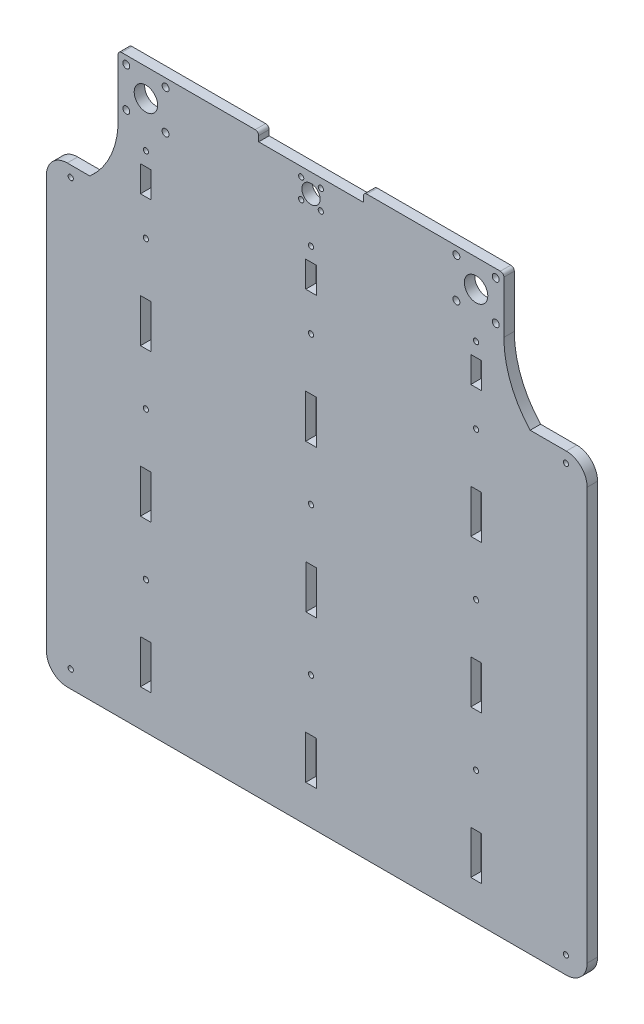
from build123d import *

# Parameters (mm, degrees)
CROQUIS1_R              = 1.5
CROQUIS1_W              = 6.2
CROQUIS1_H              = 25
CROQUIS1_H_2            = 15
CROQUIS1_R_2            = 2
CROQUIS1_R_3            = 6.75
CROQUIS1_R_4            = 5.25
SALIENTE_EXTRUIR1_DEPTH = 6


with BuildPart() as part:
    # Croquis1 → Saliente-Extruir1 (new body)
    with BuildSketch(Plane.XY):
        with BuildLine():
            Line((87.635637669, 16), (32.115377174, 16))
            ThreePointArc((32.115377174, 16), (30.701163612, 15.414213562), (30.115377174, 14))
            Line((30.115377174, 14), (30.115377174, 10.910010016))
            Line((30.115377174, 10.910010016), (-30.115377174, 10.910010016))
            Line((-30.115377174, 10.910010016), (-30.115377174, 14))
            ThreePointArc((-30.115377174, 14), (-30.701163612, 15.414213562), (-32.115377174, 16))
            Line((-32.115377174, 16), (-44.664398505, 16))
            Line((-44.664398505, 16), (-87.635637669, 16))
            Line((-87.635637669, 16), (-109, 16))
            ThreePointArc((-109, 16), (-110.414213562, 15.414213562), (-111, 14))
            Line((-111, 14), (-111, 0))
            Line((-111, 0), (-111, -15.999955929))
            ThreePointArc((-111, -15.999955929), (-114.684754838, -37.224148725), (-127.277573278, -54.701697231))
            Line((-127.277573278, -54.701697231), (-135.277573278, -54.701697231))
            Line((-135.277573278, -54.701697231), (-140.277573278, -54.701697231))
            ThreePointArc((-140.277573278, -54.701697231), (-148.762854653, -58.216415857), (-152.277573278, -66.701697231))
            Line((-152.277573278, -66.701697231), (-152.277573278, -303.912438798))
            ThreePointArc((-152.277573278, -303.912438798), (-148.762854653, -312.397720172), (-140.277573278, -315.912438798))
            Line((-140.277573278, -315.912438798), (-135.277573278, -315.912438798))
            Line((-135.277573278, -315.912438798), (-119.364295205, -315.912438798))
            Line((-119.364295205, -315.912438798), (119.364429455, -315.912438798))
            Line((119.364429455, -315.912438798), (130.295105026, -315.912438798))
            Line((130.295105026, -315.912438798), (146.942872896, -315.912438798))
            ThreePointArc((146.942872896, -315.912438798), (155.42815427, -312.397720172), (158.942872896, -303.912438798))
            Line((158.942872896, -303.912438798), (158.942872896, -70.770984471))
            Line((158.942872896, -70.770984471), (158.942872896, -66.701697231))
            ThreePointArc((158.942872896, -66.701697231), (155.42815427, -58.216415857), (146.942872896, -54.701697231))
            Line((146.942872896, -54.701697231), (126.134028278, -54.701697231))
            ThreePointArc((126.134028278, -54.701697231), (114.918041875, -36.777730062), (111, -15.999955929))
            Line((111, -15.999955929), (111, 14))
            ThreePointArc((111, 14), (110.414213562, 15.414213562), (109, 16))
            Line((109, 16), (87.635637669, 16))
        make_face()
        with Locations((-138.277573278, -305.912438798)):
            Circle(CROQUIS1_R, mode=Mode.SUBTRACT)
        with Locations((-95.05, -282.201697231)):
            Rectangle(CROQUIS1_W, CROQUIS1_H, mode=Mode.SUBTRACT)
        with Locations((-95, -239.701697231)):
            Circle(CROQUIS1_R, mode=Mode.SUBTRACT)
        Polygon((-3.049885808, -294.789219369), (-3.049896429, -269.789219369), (3.050103571, -269.789216778), (3.050114192, -294.789216778), align=None, mode=Mode.SUBTRACT)
        with Locations((9.0826e-05, -239.789218073)):
            Circle(CROQUIS1_R, mode=Mode.SUBTRACT)
        with Locations((-95.05, -197.201697231)):
            Rectangle(CROQUIS1_W, CROQUIS1_H, mode=Mode.SUBTRACT)
        with Locations((-95, -154.701697231)):
            Circle(CROQUIS1_R, mode=Mode.SUBTRACT)
        Polygon((-2.949921919, -209.789219327), (-2.94993254, -184.789219327), (3.15006746, -184.789216735), (3.150078081, -209.789216735), align=None, mode=Mode.SUBTRACT)
        with Locations((5.4715e-05, -154.789218073)):
            Circle(CROQUIS1_R, mode=Mode.SUBTRACT)
        Polygon((91.950125201, -294.701658167), (91.95011458, -269.701658167), (98.15011458, -269.701655533), (98.150125201, -294.701655533), align=None, mode=Mode.SUBTRACT)
        with Locations((146.722426722, -305.912438798)):
            Circle(CROQUIS1_R, mode=Mode.SUBTRACT)
        with Locations((95.000101835, -239.701656871)):
            Circle(CROQUIS1_R, mode=Mode.SUBTRACT)
        Polygon((91.95008909, -209.701658167), (91.950078469, -184.701658167), (98.150078469, -184.701655533), (98.15008909, -209.701655533), align=None, mode=Mode.SUBTRACT)
        with Locations((95.000065724, -154.701656871)):
            Circle(CROQUIS1_R, mode=Mode.SUBTRACT)
        with Locations((-95.05, -112.201697231)):
            Rectangle(CROQUIS1_W, CROQUIS1_H, mode=Mode.SUBTRACT)
        with Locations((-95, -69.701697231)):
            Circle(CROQUIS1_R, mode=Mode.SUBTRACT)
        Polygon((-3.04995803, -124.789219369), (-3.049968651, -99.789219369), (3.150031349, -99.789216735), (3.15004197, -124.789216735), align=None, mode=Mode.SUBTRACT)
        with Locations((1.8603e-05, -69.789218073)):
            Circle(CROQUIS1_R, mode=Mode.SUBTRACT)
        with Locations((-138.277573278, -60.912438798)):
            Circle(CROQUIS1_R, mode=Mode.SUBTRACT)
        with Locations((-95.05, -41.5)):
            Rectangle(CROQUIS1_W, CROQUIS1_H_2, mode=Mode.SUBTRACT)
        with Locations((-95, -26)):
            Circle(CROQUIS1_R, mode=Mode.SUBTRACT)
        with Locations((-106.313708499, -11.313708499)):
            Circle(CROQUIS1_R_2, mode=Mode.SUBTRACT)
        with Locations((-83.686291501, -11.313708499)):
            Circle(CROQUIS1_R_2, mode=Mode.SUBTRACT)
        with Locations((-95, 0)):
            Circle(CROQUIS1_R_3, mode=Mode.SUBTRACT)
        with Locations((-106.313708499, 11.313708499)):
            Circle(CROQUIS1_R_2, mode=Mode.SUBTRACT)
        with Locations((-83.686291501, 11.313708499)):
            Circle(CROQUIS1_R_2, mode=Mode.SUBTRACT)
        Polygon((-3.049990229, -48.999960936), (-3.049996601, -33.999960936), (3.150003399, -33.999958302), (3.150009771, -48.999958302), align=None, mode=Mode.SUBTRACT)
        with Locations((0.004600085, -25.999981675)):
            Circle(CROQUIS1_R, mode=Mode.SUBTRACT)
        with Locations((-5.656854249, -5.656854249)):
            Circle(CROQUIS1_R, mode=Mode.SUBTRACT)
        Circle(CROQUIS1_R_4, mode=Mode.SUBTRACT)
        with Locations((-5.656854249, 5.656854249)):
            Circle(CROQUIS1_R, mode=Mode.SUBTRACT)
        Polygon((91.950052978, -124.701658167), (91.950042357, -99.701658167), (98.150042357, -99.701655533), (98.150052978, -124.701655533), align=None, mode=Mode.SUBTRACT)
        with Locations((95.000029612, -69.701656871)):
            Circle(CROQUIS1_R, mode=Mode.SUBTRACT)
        with Locations((5.656854249, -5.656854249)):
            Circle(CROQUIS1_R, mode=Mode.SUBTRACT)
        with Locations((5.656854249, 5.656854249)):
            Circle(CROQUIS1_R, mode=Mode.SUBTRACT)
        Polygon((91.950020817, -48.999960936), (91.950014445, -33.999960936), (98.150014445, -33.999958302), (98.150020817, -48.999958302), align=None, mode=Mode.SUBTRACT)
        with Locations((95.000011046, -25.99995964)):
            Circle(CROQUIS1_R, mode=Mode.SUBTRACT)
        with Locations((146.722426722, -60.912438798)):
            Circle(CROQUIS1_R, mode=Mode.SUBTRACT)
        with Locations((83.686291501, -11.313708499)):
            Circle(CROQUIS1_R_2, mode=Mode.SUBTRACT)
        with Locations((106.313708499, -11.313708499)):
            Circle(CROQUIS1_R_2, mode=Mode.SUBTRACT)
        with Locations((95, 0)):
            Circle(CROQUIS1_R_3, mode=Mode.SUBTRACT)
        with Locations((83.686291501, 11.313708499)):
            Circle(CROQUIS1_R_2, mode=Mode.SUBTRACT)
        with Locations((106.313708499, 11.313708499)):
            Circle(CROQUIS1_R_2, mode=Mode.SUBTRACT)
    extrude(amount=SALIENTE_EXTRUIR1_DEPTH)


solid = part.part
